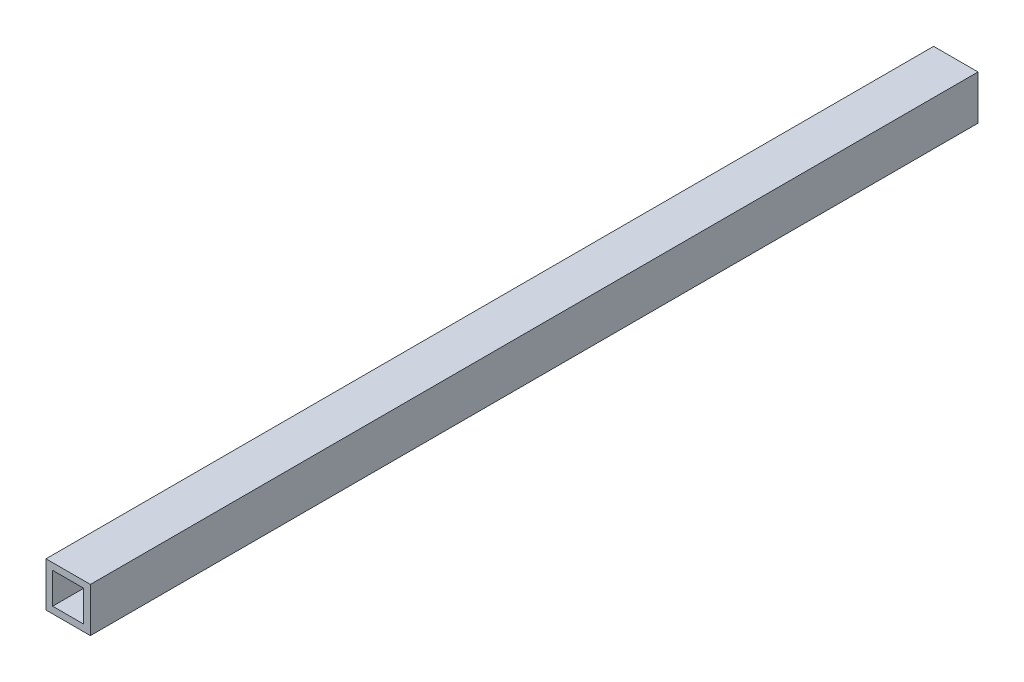
from build123d import *

# Parameters (mm, degrees)
SKETCH_1_W      = 10
SKETCH_1_H      = 10
SKETCH_1_W_2    = 7
SKETCH_1_H_2    = 7
EXTRUDE_1_DEPTH = 200


with BuildPart() as part:
    # 草图1 → 凸台-拉伸1 (new body)
    with BuildSketch(Plane.XY):
        Rectangle(SKETCH_1_W, SKETCH_1_H)
        Rectangle(SKETCH_1_W_2, SKETCH_1_H_2, mode=Mode.SUBTRACT)
    extrude(amount=EXTRUDE_1_DEPTH)


solid = part.part
